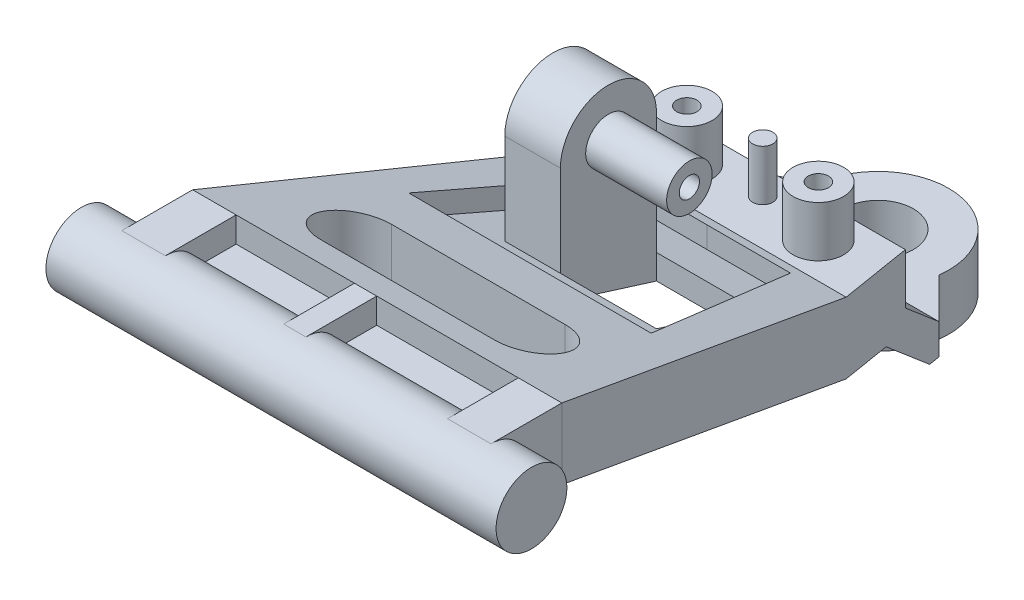
from build123d import *

# Parameters (mm, degrees)
BOSS_EXTRUDE1_DEPTH             = 36.5
CUT_EXTRUDE1_DEPTH              = 76.543034093
CUT_EXTRUDE1_DEPTH_BACK         = 36.5
SKETCH2_R                       = 3.5
SKETCH2_W                       = 9.5
SKETCH2_H                       = 9.5
SKETCH5_W                       = 11.7
SKETCH5_H                       = 7
SKETCH5_W_2                     = 14
CUT_EXTRUDE2_DEPTH              = 2.5
SKETCH6_W                       = 14
SKETCH6_H                       = 7
SKETCH6_W_2                     = 11.7
CUT_EXTRUDE3_DEPTH              = 2.5
BOSS_EXTRUDE2_DEPTH             = 4
BOSS_EXTRUDE2_DEPTH_BACK        = 40.5
SKETCH3_R                       = 3.5
CUT_EXTRUDE4_REACH              = 79.555
CUT_EXTRUDE5_REACH              = 80.463
BOSS_EXTRUDE3_DEPTH             = 5.5
SKETCH10_R                      = 2.25
SKETCH10_R_2                    = 1
BOSS_EXTRUDE4_DEPTH             = 8
SKETCH11_R                      = 2.5
SKETCH11_R_2                    = 1
BOSS_EXTRUDE5_DEPTH             = 5
CUT_EXTRUDE7_DEPTH              = 12
CUT_EXTRUDE8_START              = 14.5
CUT_EXTRUDE8_DEPTH              = 8.25
CUT_EXTRUDE9_START              = 25.25
CUT_EXTRUDE9_DEPTH              = 8
SKETCH14_R                      = 7
SKETCH14_R_2                    = 3.5
BOSS_EXTRUDE6_DEPTH             = 2.5
BOSS_EXTRUDE6_DIRECTION_2_REACH = 82.238


with BuildPart() as part:
    # Sketch1 → Boss-Extrude1 (new body)
    with BuildSketch(Plane(origin=(0, 0, 0), x_dir=(0, 0, -1), z_dir=(1, 0, 0))):
        with BuildLine():
            Line((7, -3.5), (40.607142857, -14))
            Line((40.607142857, -14), (45.75, -18.5))
            Line((45.75, -18.5), (49.75, -18.5))
            Line((49.75, -18.5), (63.5, -18.5))
            Line((63.5, -18.5), (63.5, -15.5))
            Line((63.5, -15.5), (51.607142857, -15.5))
            Line((51.607142857, -15.5), (47.607142857, -12))
            Line((47.607142857, -12), (47.607142857, -7))
            Line((47.607142857, -7), (40.607142857, -7))
            Line((40.607142857, -7), (7, 3.5))
            Line((7, 3.5), (0, 3.5))
            ThreePointArc((0, 3.5), (-3.5, 0), (0, -3.5))
            Line((0, -3.5), (7, -3.5))
        make_face()
    extrude(amount=BOSS_EXTRUDE1_DEPTH)

    # Sketch2 → Cut-Extrude1 (cut, two sides: drawn at the far end of the back side and taken through both)
    with BuildSketch(Plane(origin=(0, 0, 0), x_dir=(1, 0, 0), z_dir=(0, 1, 0)).offset(-CUT_EXTRUDE1_DEPTH_BACK)):
        with Locations(Location((18.25, 56.5, 0), (0, 0, 90))):
            Circle(SKETCH2_R)
        with BuildLine():
            Line((25.192824074, 55.607142857), (29.192824074, 51.607142857))
            Line((29.192824074, 51.607142857), (36.5, 7))
            Line((36.5, 7), (46.5, 7))
            Line((46.5, 7), (46.5, 73.5))
            Line((46.5, 73.5), (-10, 73.5))
            Line((-10, 73.5), (-10, 7))
            Line((-10, 7), (0, 7))
            Line((0, 7), (7.962423087, 55.607142857))
            Line((7.962423087, 55.607142857), (11.338109181, 57.607142857))
            ThreePointArc((11.338109181, 57.607142857), (19.250119601, 63.428185966), (25.192824074, 55.607142857))
        make_face()
        with BuildLine():
            Line((9.678067434, 17), (26.821932566, 17))
            ThreePointArc((26.821932566, 17), (30.321932566, 13.5), (26.821932566, 10))
            Line((26.821932566, 10), (9.678067434, 10))
            ThreePointArc((9.678067434, 10), (6.178067434, 13.5), (9.678067434, 17))
        make_face()
        with Locations((22, 30.857142857)):
            Rectangle(SKETCH2_W, SKETCH2_H)
    extrude(amount=CUT_EXTRUDE1_DEPTH + CUT_EXTRUDE1_DEPTH_BACK, mode=Mode.SUBTRACT)

    # Sketch5 → Cut-Extrude2 (cut)
    with BuildSketch(Plane(origin=(0, 3.5, 0), x_dir=(1, 0, 0), z_dir=(0, 1, 0))):
        with Locations((10.15, 3.5)):
            Rectangle(SKETCH5_W, SKETCH5_H)
        with Locations((25.2, 3.5)):
            Rectangle(SKETCH5_W_2, SKETCH5_H)
    extrude(amount=-CUT_EXTRUDE2_DEPTH, mode=Mode.SUBTRACT)

    # Sketch6 → Cut-Extrude3 (cut)
    with BuildSketch(Plane.XZ.offset(3.5)):
        with Locations((25.2, -3.5)):
            Rectangle(SKETCH6_W, SKETCH6_H)
        with Locations((10.15, -3.5)):
            Rectangle(SKETCH6_W_2, SKETCH6_H)
    extrude(amount=-CUT_EXTRUDE3_DEPTH, mode=Mode.SUBTRACT)

    # Sketch3 → Boss-Extrude2 (add, two sides: drawn at the far end of the back side and taken through both)
    with BuildSketch(Plane(origin=(36.5, 0, 0), x_dir=(0, 0, -1), z_dir=(1, 0, 0)).offset(-BOSS_EXTRUDE2_DEPTH_BACK)):
        Circle(SKETCH3_R)
    extrude(amount=BOSS_EXTRUDE2_DEPTH + BOSS_EXTRUDE2_DEPTH_BACK)

    # Cut-Extrude4: up to this plane
    cut_extrude4_end = Plane(origin=(36.5, 0.954324111, -8.391680434), z_dir=(0, 0.9544980251192885, -0.2982172363284494))
    # Sketch7 → Cut-Extrude4 (cut, up to the surface)
    with BuildSketch(Plane(origin=(0, 0, 0), x_dir=(1, 0, 0), z_dir=(0, 1, 0)), mode=Mode.PRIVATE) as cut_extrude4_sk1:
        Polygon((18.222476089, 22.107142857), (30.222476089, 22.107142857), (26.498512221, 39.607142857), (18.248512221, 39.607142857), (9.998548743, 39.631691156), (6.222529213, 22.142849473), align=None)
    cut_extrude4_tool1 = split(extrude(cut_extrude4_sk1.sketch, amount=-CUT_EXTRUDE4_REACH, mode=Mode.PRIVATE), bisect_by=cut_extrude4_end, keep=Keep.BOTH, mode=Mode.PRIVATE)
    add(cut_extrude4_tool1.solids().sort_by_distance((18.234702, 0, -30.324637))[0], mode=Mode.SUBTRACT)

    # Cut-Extrude5: up to this plane
    cut_extrude5_end = Plane(origin=(36.5, -1.272837948, -7.695840216), z_dir=(0, 0.9544980251192885, -0.2982172363284494))
    # Sketch8 → Cut-Extrude5 (cut, up to the surface)
    with BuildSketch(Plane(origin=(0, -18.5, 0), x_dir=(1, 0, 0), z_dir=(0, 1, 0)), mode=Mode.PRIVATE) as cut_extrude5_sk1:
        Polygon((18.222476089, 22.107142857), (30.222476089, 22.107142857), (26.498512221, 39.607142857), (18.248512221, 39.607142857), (9.998548743, 39.631691156), (6.222529213, 22.142849473), align=None)
    cut_extrude5_tool1 = split(extrude(cut_extrude5_sk1.sketch, amount=CUT_EXTRUDE5_REACH, mode=Mode.PRIVATE), bisect_by=cut_extrude5_end, keep=Keep.BOTH, mode=Mode.PRIVATE)
    add(cut_extrude5_tool1.solids().sort_by_distance((18.234702, -18.5, -30.324637))[0], mode=Mode.SUBTRACT)

    # Sketch9 → Boss-Extrude3 (add)
    with BuildSketch(Plane(origin=(17.25, 0, 0), x_dir=(0, 0, -1), z_dir=(1, 0, 0))):
        with BuildLine():
            Line((26.107142857, -4.580581258), (26.107142857, 4.419418742))
            ThreePointArc((26.107142857, 4.419418742), (30.857142857, 9.169418742), (35.607142857, 4.419418742))
            Line((35.607142857, 4.419418742), (35.607142857, -7.548700281))
            Line((35.607142857, -7.548700281), (26.107142857, -4.580581258))
        make_face()
    extrude(amount=-BOSS_EXTRUDE3_DEPTH)

    # Sketch10 → Boss-Extrude4 (add)
    with BuildSketch(Plane(origin=(17.25, 0, 0), x_dir=(0, 0, -1), z_dir=(1, 0, 0))):
        with Locations((30.857142857, 4.419418742)):
            Circle(SKETCH10_R)
        with Locations((30.857142857, 4.419418742)):
            Circle(SKETCH10_R_2, mode=Mode.SUBTRACT)
    extrude(amount=BOSS_EXTRUDE4_DEPTH)

    # Sketch11 → Boss-Extrude5 (add)
    # profile 1 of 3: a face of its own
    with BuildSketch(Plane(origin=(0, -7, 0), x_dir=(1, 0, 0), z_dir=(0, 1, 0))):
        with Locations(Location((11.75, 44.107142857, 0), (0, 0, 90))):
            Circle(SKETCH11_R)
        with Locations(Location((11.75, 44.107142857, 0), (0, 0, 270))):
            Circle(SKETCH11_R_2, mode=Mode.SUBTRACT)
    # profile 2 of 3: a face of its own
    with BuildSketch(Plane(origin=(0, -7, 0), x_dir=(1, 0, 0), z_dir=(0, 1, 0))):
        with Locations(Location((18.25, 45.107142857, 0), (0, 0, 90))):
            Circle(SKETCH11_R_2)
    # profile 3 of 3: a face of its own
    with BuildSketch(Plane(origin=(0, -7, 0), x_dir=(1, 0, 0), z_dir=(0, 1, 0))):
        with Locations(Location((24.75, 44.107142857, 0), (0, 0, 90))):
            Circle(SKETCH11_R)
        with Locations(Location((24.75, 44.107142857, 0), (0, 0, 90))):
            Circle(SKETCH11_R_2, mode=Mode.SUBTRACT)
    extrude(amount=BOSS_EXTRUDE5_DEPTH)

    # Sketch13 → Cut-Extrude7 (cut)
    with BuildSketch(Plane(origin=(0, 0, 0), x_dir=(0, 0, -1), z_dir=(1, 0, 0))):
        Polygon((53.908508937, -21.5), (45.337080366, -14), (40.607142857, -14), (40.607142857, -21.5), align=None)
    extrude(amount=CUT_EXTRUDE7_DEPTH, mode=Mode.SUBTRACT)

    # Sketch13<3> → Cut-Extrude8 (cut)
    with BuildSketch(Plane(origin=(0, 0, 0), x_dir=(0, 0, -1), z_dir=(1, 0, 0)).offset(CUT_EXTRUDE8_START)):
        Polygon((53.908508937, -21.5), (45.337080366, -14), (40.607142857, -14), (40.607142857, -21.5), align=None)
    extrude(amount=CUT_EXTRUDE8_DEPTH, mode=Mode.SUBTRACT)

    # Sketch13<4> → Cut-Extrude9 (cut)
    with BuildSketch(Plane(origin=(0, 0, 0), x_dir=(0, 0, -1), z_dir=(1, 0, 0)).offset(CUT_EXTRUDE9_START)):
        Polygon((53.908508937, -21.5), (45.337080366, -14), (40.607142857, -14), (40.607142857, -21.5), align=None)
    extrude(amount=CUT_EXTRUDE9_DEPTH, mode=Mode.SUBTRACT)

    # Sketch14 → Boss-Extrude6 (add)
    with BuildSketch(Plane.XZ.offset(18.5)):
        with Locations(Location((18.25, -56.5, 0), (0, 0, 270))):
            Circle(SKETCH14_R)
        with Locations(Location((18.25, -56.5, 0), (0, 0, 270))):
            Circle(SKETCH14_R_2, mode=Mode.SUBTRACT)
    extrude(amount=BOSS_EXTRUDE6_DEPTH)

    # Boss-Extrude6 direction 2: up to this face of the body (flat: up to its plane)
    boss_extrude6_direction_2_end = Plane(part.part.faces().sort_by_distance((27.530853261, -16.180546647, -47.829133677))[0])
    # Sketch14 → Boss-Extrude6 direction 2 (add, up to the picked face)
    with BuildSketch(Plane.XZ.offset(18.5), mode=Mode.PRIVATE) as boss_extrude6_direction_2_sk1:
        with Locations(Location((18.25, -56.5, 0), (0, 0, 270))):
            Circle(SKETCH14_R)
        with Locations(Location((18.25, -56.5, 0), (0, 0, 270))):
            Circle(SKETCH14_R_2, mode=Mode.SUBTRACT)
    boss_extrude6_direction_2_tool1 = split(extrude(boss_extrude6_direction_2_sk1.sketch, amount=-BOSS_EXTRUDE6_DIRECTION_2_REACH, mode=Mode.PRIVATE), bisect_by=boss_extrude6_direction_2_end, keep=Keep.BOTH, mode=Mode.PRIVATE)
    add(boss_extrude6_direction_2_tool1.solids().sort_by(Axis((18.25, -18.5, -49.69799), (0, 1, 0)))[0])


solid = part.part
